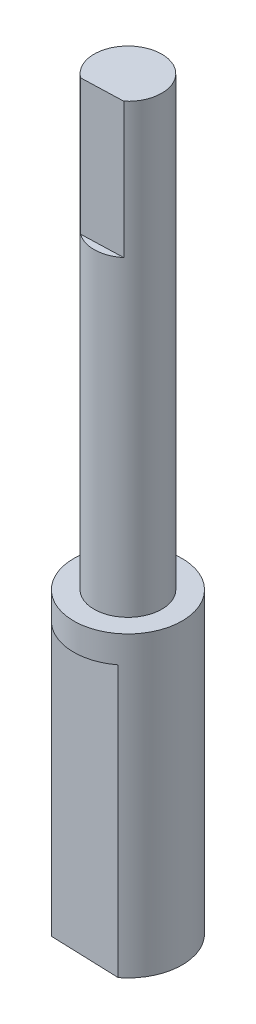
from build123d import *

# Parameters (mm, degrees)
SKETCH1_R           = 4
BOSS_EXTRUDE1_DEPTH = 55
CUT_EXTRUDE1_DEPTH  = 20
CUT_EXTRUDE2_START  = -33
SKETCH3_R           = 4
SKETCH3_R_2         = 2.5
CUT_EXTRUDE2_DEPTH  = 33
CUT_EXTRUDE3_START  = -10
CUT_EXTRUDE3_DEPTH  = 10


with BuildPart() as part:
    # Sketch1 → Boss-Extrude1 (new body)
    with BuildSketch(Plane(origin=(0, 0, 0), x_dir=(1, 0, 0), z_dir=(0, 1, 0))):
        with Locations(Location((0, 0, 0), (0, 0, 270))):
            Circle(SKETCH1_R)
    extrude(amount=BOSS_EXTRUDE1_DEPTH)

    # Sketch2 → Cut-Extrude1 (cut)
    with BuildSketch(Plane.XZ):
        with BuildLine():
            Line((-2.661339853, 2.986179865), (2.444122866, 3.166427547))
            ThreePointArc((2.444122866, 3.166427547), (-0.14113154, 3.997509461), (-2.661339853, 2.986179865))
        make_face()
    extrude(amount=-CUT_EXTRUDE1_DEPTH, mode=Mode.SUBTRACT)

    # Sketch3 → Cut-Extrude2 (cut)
    with BuildSketch(Plane(origin=(0, 55, 0), x_dir=(1, 0, 0), z_dir=(0, 1, 0)).offset(CUT_EXTRUDE2_START)):
        with Locations(Location((0, 0, 0), (0, 0, 228.291972002))):
            Circle(SKETCH3_R)
        with Locations(Location((0, 0, 0), (0, 0, 270))):
            Circle(SKETCH3_R_2, mode=Mode.SUBTRACT)
    extrude(amount=CUT_EXTRUDE2_DEPTH, mode=Mode.SUBTRACT)

    # Sketch6 → Cut-Extrude3 (cut)
    with BuildSketch(Plane(origin=(0, 55, 0), x_dir=(1, 0, 0), z_dir=(0, 1, 0)).offset(CUT_EXTRUDE3_START)):
        with BuildLine():
            Line((-1.479257304, -2.015390242), (1.606973788, -1.915107111))
            ThreePointArc((1.606973788, -1.915107111), (0.081191451, -2.498681242), (-1.479257304, -2.015390242))
        make_face()
    extrude(amount=CUT_EXTRUDE3_DEPTH, mode=Mode.SUBTRACT)


solid = part.part
